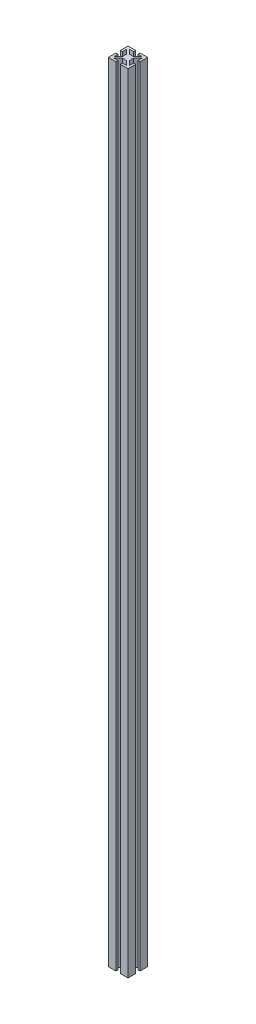
from build123d import *

# Parameters (mm, degrees)
BOSS_EXTRUDE1_DEPTH = 1524


with BuildPart() as part:
    # Sketch2 → Boss-Extrude1 (new body)
    with BuildSketch(Plane(origin=(0.594697292, 0, 0.594697292), x_dir=(1, 0, 0), z_dir=(0, 1, 0))):
        Polygon((-19.644697292, 19.644697292), (-4.658697292, 19.644697292), (-4.658697292, 15.580697292), (-12.707015333, 15.580697292), (-4.477415333, 7.351097292), (3.288020749, 7.351097292), (11.517620749, 15.580697292), (3.469302708, 15.580697292), (3.469302708, 19.644697292), (18.455302708, 19.644697292), (18.455302708, 4.658697292), (14.391302708, 4.658697292), (14.391302708, 12.707015333), (6.161702708, 4.477415333), (6.161702708, -3.288020749), (14.391302708, -11.517620749), (14.391302708, -3.469302708), (18.455302708, -3.469302708), (18.455302708, -18.455302708), (3.469302708, -18.455302708), (3.469302708, -14.391302708), (11.517620749, -14.391302708), (3.288020749, -6.161702708), (-4.477415333, -6.161702708), (-12.707015333, -14.391302708), (-4.658697292, -14.391302708), (-4.658697292, -18.455302708), (-19.644697292, -18.455302708), (-19.644697292, -3.469302708), (-15.580697292, -3.469302708), (-15.580697292, -11.517620749), (-7.351097292, -3.288020749), (-7.351097292, 4.477415333), (-15.580697292, 12.707015333), (-15.580697292, 4.658697292), (-19.644697292, 4.658697292), align=None)
    extrude(amount=BOSS_EXTRUDE1_DEPTH)


solid = part.part
